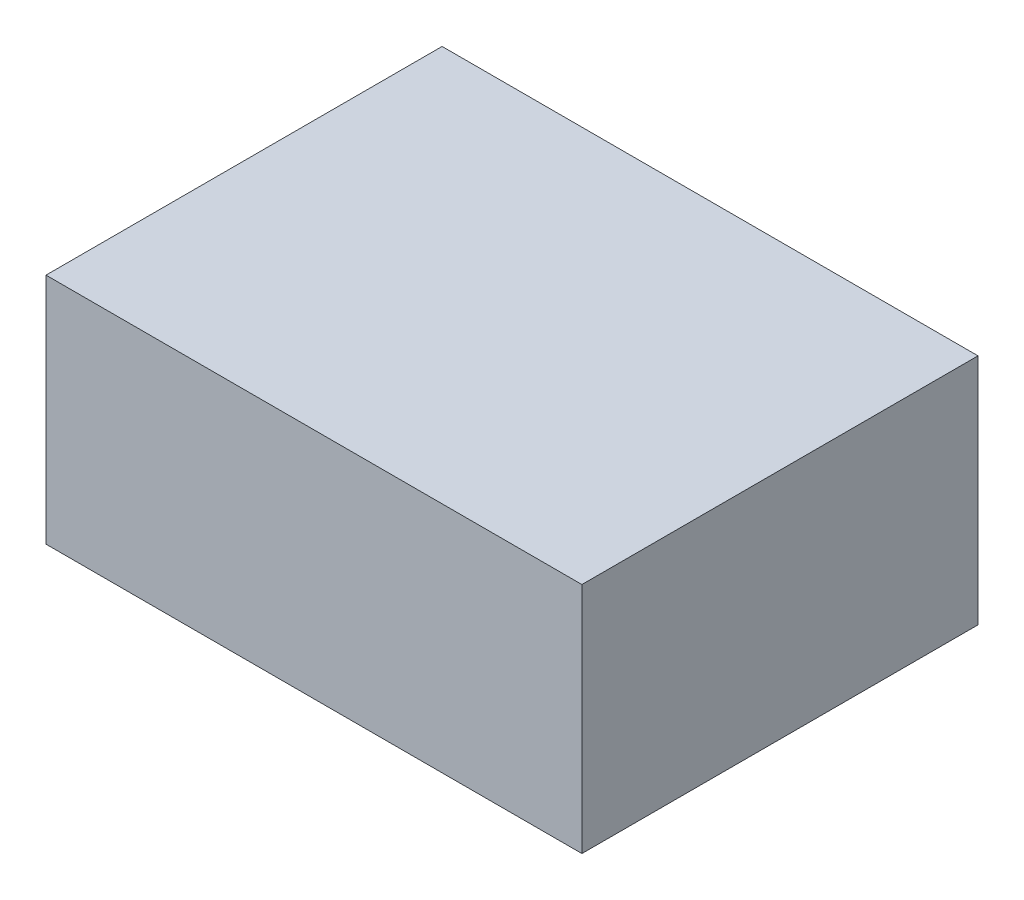
from build123d import *

# Parameters (mm, degrees)
SKETCH1_W           = 230
SKETCH1_H           = 170
BOSS_EXTRUDE1_DEPTH = 100


with BuildPart() as part:
    # Sketch1 → Boss-Extrude1 (new body)
    with BuildSketch(Plane(origin=(0, 0, 0), x_dir=(1, 0, 0), z_dir=(0, 1, 0))):
        with Locations((115, -85)):
            Rectangle(SKETCH1_W, SKETCH1_H)
    extrude(amount=BOSS_EXTRUDE1_DEPTH)


solid = part.part
